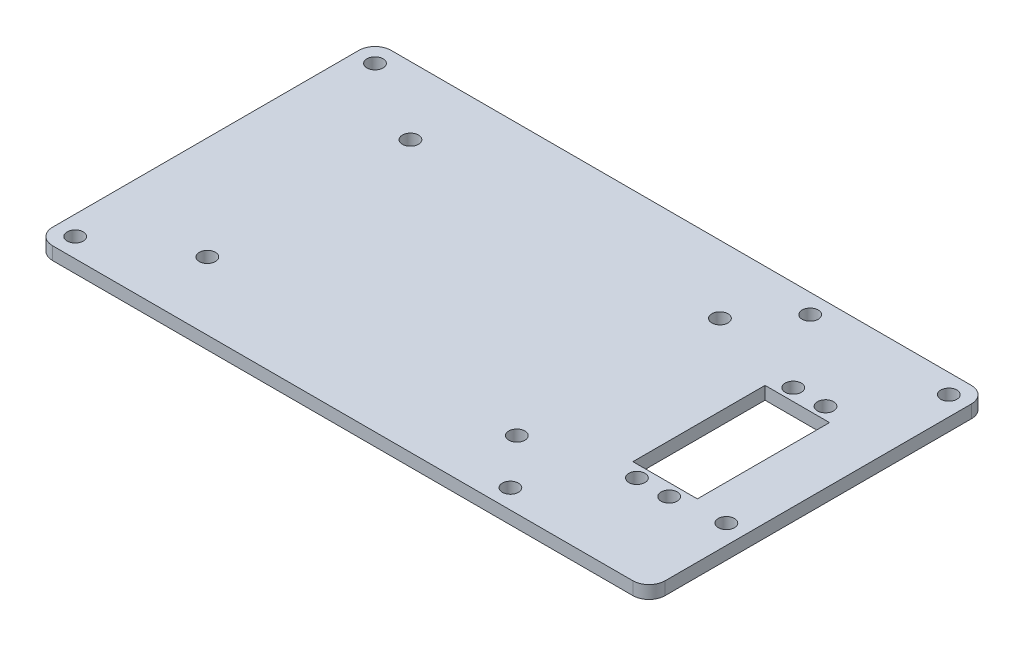
from build123d import *

# Parameters (mm, degrees)
SKETCH_1_W      = 190
SKETCH_1_H      = 105
SKETCH_1_R      = 2.5
SKETCH_1_W_2    = 20
SKETCH_1_H_2    = 41
EXTRUDE_1_DEPTH = 4
FILLET_1_R      = 5


with BuildPart() as part:
    # 草图1 → 凸台-拉伸1 (new body)
    with BuildSketch(Plane(origin=(0, 0, 0), x_dir=(1, 0, 0), z_dir=(0, 1, 0))):
        Rectangle(SKETCH_1_W, SKETCH_1_H)
        with Locations(Location((-89, 46.5, 0), (0, 0, 270))):
            Circle(SKETCH_1_R, mode=Mode.SUBTRACT)
        with Locations(Location((89, 46.5, 0), (0, 0, 270))):
            Circle(SKETCH_1_R, mode=Mode.SUBTRACT)
        with Locations(Location((-89, -46.5, 0), (0, 0, 270))):
            Circle(SKETCH_1_R, mode=Mode.SUBTRACT)
        with Locations(Location((-63, 31.5, 0), (0, 0, 270))):
            Circle(SKETCH_1_R, mode=Mode.SUBTRACT)
        with Locations(Location((33, 31.5, 0), (0, 0, 270))):
            Circle(SKETCH_1_R, mode=Mode.SUBTRACT)
        with Locations(Location((-63, -31.5, 0), (0, 0, 270))):
            Circle(SKETCH_1_R, mode=Mode.SUBTRACT)
        with Locations(Location((33, -31.5, 0), (0, 0, 270))):
            Circle(SKETCH_1_R, mode=Mode.SUBTRACT)
        with Locations(Location((63, 24.25, 0), (0, 0, 270))):
            Circle(SKETCH_1_R, mode=Mode.SUBTRACT)
        with Locations(Location((73, 24.25, 0), (0, 0, 270))):
            Circle(SKETCH_1_R, mode=Mode.SUBTRACT)
        with Locations(Location((63, -24.25, 0), (0, 0, 270))):
            Circle(SKETCH_1_R, mode=Mode.SUBTRACT)
        with Locations(Location((73, -24.25, 0), (0, 0, 270))):
            Circle(SKETCH_1_R, mode=Mode.SUBTRACT)
        with Locations(Location((46, -46.5, 0), (0, 0, 270))):
            Circle(SKETCH_1_R, mode=Mode.SUBTRACT)
        with Locations(Location((46, 46.5, 0), (0, 0, 270))):
            Circle(SKETCH_1_R, mode=Mode.SUBTRACT)
        with Locations(Location((89, -22.5, 0), (0, 0, 270))):
            Circle(SKETCH_1_R, mode=Mode.SUBTRACT)
        with Locations((68, 0)):
            Rectangle(SKETCH_1_W_2, SKETCH_1_H_2, mode=Mode.SUBTRACT)
    extrude(amount=EXTRUDE_1_DEPTH)

    # 圆角1
    fillet_1_edges = [part.edges().sort_by_distance(p)[0] for p in [
        (95, 2, 52.5),
        (-95, 2, 52.5),
        (-95, 2, -52.5),
        (95, 2, -52.5),
    ]]
    fillet(fillet_1_edges, radius=FILLET_1_R)


solid = part.part
